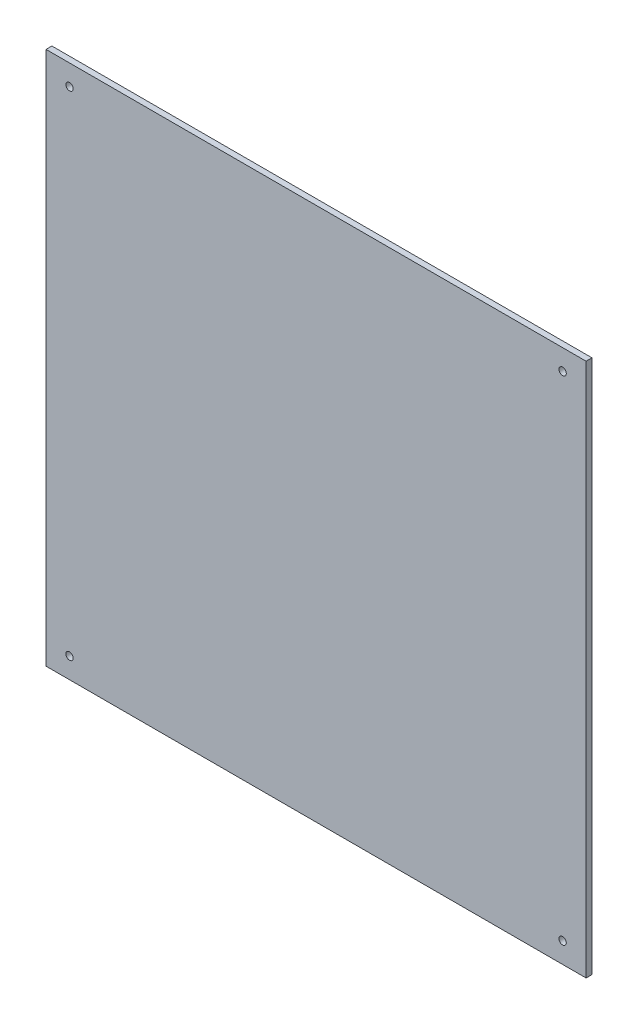
from build123d import *

# Parameters (mm, degrees)
SKETCH_1_W      = 184
SKETCH_1_H      = 182
EXTRUDE_1_DEPTH = 2
M3X0_5_1_D      = 2.5


with BuildPart() as part:
    # ｽｹｯﾁ1 → ﾎﾞｽ - 押し出し1 (new body)
    with BuildSketch(Plane.XY):
        with Locations((92, 91)):
            Rectangle(SKETCH_1_W, SKETCH_1_H)
    extrude(amount=EXTRUDE_1_DEPTH)

    # M3x0.5 ねじ穴1 (through all)
    with Locations(Plane.XY.offset(2)):
        with Locations((8, 175), (8, 7), (176, 7), (176, 175)):
            Hole(M3X0_5_1_D / 2)


solid = part.part
